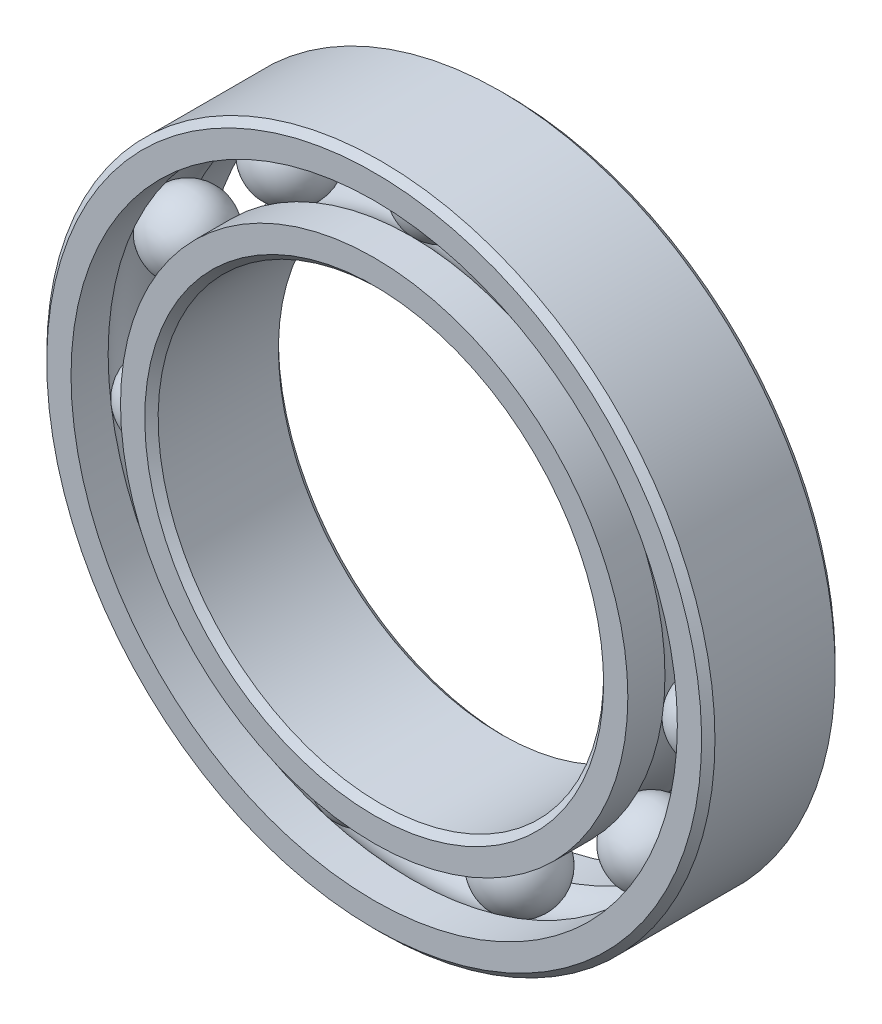
from build123d import *

# Parameters (mm, degrees)
CIRPATTERN1_COUNT = 11


with BuildPart() as part:
    # Sketch6 → Revolve5 (revolve)
    with BuildSketch(Plane(origin=(0, 0, 0), x_dir=(0, 0, -1), z_dir=(1, 0, 0)), mode=Mode.PRIVATE) as revolve5_sk:
        with BuildLine():
            Line((1.35, 7.5), (1.5, 7.35))
            Line((1.5, 7.35), (1.5, 6.805555556))
            Line((1.5, 6.805555556), (0.666666667, 6.805555556))
            ThreePointArc((0.666666667, 6.805555556), (0, 7.11780552), (-0.666666667, 6.805555556))
            Line((-0.666666667, 6.805555556), (-1.5, 6.805555556))
            Line((-1.5, 6.805555556), (-1.5, 7.35))
            Line((-1.5, 7.35), (-1.35, 7.5))
            Line((-1.35, 7.5), (1.35, 7.5))
        make_face()
    revolve(revolve5_sk.sketch.rotate(Axis((0, 0, 1.5), (0, 0, -1)), 180), axis=Axis((0, 0, 1.5), (0, 0, -1)))


with BuildPart() as body_2:
    # Sketch3 → Revolve3 (revolve)
    with BuildSketch(Plane(origin=(0, 0, 0), x_dir=(0, 0, -1), z_dir=(1, 0, 0)), mode=Mode.PRIVATE) as revolve3_sk:
        with BuildLine():
            Line((-1.5, 5.694444444), (-0.666666667, 5.694444444))
            ThreePointArc((-0.666666667, 5.694444444), (0, 5.38219448), (0.666666667, 5.694444444))
            Line((0.666666667, 5.694444444), (1.5, 5.694444444))
            Line((1.5, 5.694444444), (1.5, 5.15))
            Line((1.5, 5.15), (1.35, 5))
            Line((1.35, 5), (-1.35, 5))
            Line((-1.35, 5), (-1.5, 5.15))
            Line((-1.5, 5.15), (-1.5, 5.694444444))
        make_face()
    revolve(revolve3_sk.sketch.rotate(Axis((0, 0, 1.5), (0, 0, -1)), 180), axis=Axis((0, 0, 1.5), (0, 0, -1)))


with BuildPart() as body_3:
    # Sketch4 → Revolve4 (revolve)
    with BuildSketch(Plane(origin=(0, 0, 0), x_dir=(0, 0, -1), z_dir=(1, 0, 0))):
        with BuildLine():
            Line((-0.86780552, 6.25), (0.86780552, 6.25))
            ThreePointArc((0.86780552, 6.25), (0, 7.11780552), (-0.86780552, 6.25))
        make_face()
    revolve(axis=Axis((0, 6.25, 0.86780552), (0, 0, -1)))


with BuildPart() as cirpattern1_1:
    # CirPattern1: pattern copy
    add(body_3.part.rotate(Axis((0, 0, 0), (0, 0, 1)), 1 * 360 / CIRPATTERN1_COUNT))


with BuildPart() as cirpattern1_2:
    # CirPattern1: pattern copy
    add(body_3.part.rotate(Axis((0, 0, 0), (0, 0, 1)), 2 * 360 / CIRPATTERN1_COUNT))


with BuildPart() as cirpattern1_3:
    # CirPattern1: pattern copy
    add(body_3.part.rotate(Axis((0, 0, 0), (0, 0, 1)), 3 * 360 / CIRPATTERN1_COUNT))


with BuildPart() as cirpattern1_4:
    # CirPattern1: pattern copy
    add(body_3.part.rotate(Axis((0, 0, 0), (0, 0, 1)), 4 * 360 / CIRPATTERN1_COUNT))


with BuildPart() as cirpattern1_5:
    # CirPattern1: pattern copy
    add(body_3.part.rotate(Axis((0, 0, 0), (0, 0, 1)), 5 * 360 / CIRPATTERN1_COUNT))


with BuildPart() as cirpattern1_6:
    # CirPattern1: pattern copy
    add(body_3.part.rotate(Axis((0, 0, 0), (0, 0, 1)), 6 * 360 / CIRPATTERN1_COUNT))


with BuildPart() as cirpattern1_7:
    # CirPattern1: pattern copy
    add(body_3.part.rotate(Axis((0, 0, 0), (0, 0, 1)), 7 * 360 / CIRPATTERN1_COUNT))


with BuildPart() as cirpattern1_8:
    # CirPattern1: pattern copy
    add(body_3.part.rotate(Axis((0, 0, 0), (0, 0, 1)), 8 * 360 / CIRPATTERN1_COUNT))


with BuildPart() as cirpattern1_9:
    # CirPattern1: pattern copy
    add(body_3.part.rotate(Axis((0, 0, 0), (0, 0, 1)), 9 * 360 / CIRPATTERN1_COUNT))


with BuildPart() as cirpattern1_10:
    # CirPattern1: pattern copy
    add(body_3.part.rotate(Axis((0, 0, 0), (0, 0, 1)), 10 * 360 / CIRPATTERN1_COUNT))


solid = Compound([part.part, body_2.part, body_3.part, cirpattern1_1.part, cirpattern1_2.part, cirpattern1_3.part, cirpattern1_4.part, cirpattern1_5.part, cirpattern1_6.part, cirpattern1_7.part, cirpattern1_8.part, cirpattern1_9.part, cirpattern1_10.part])
